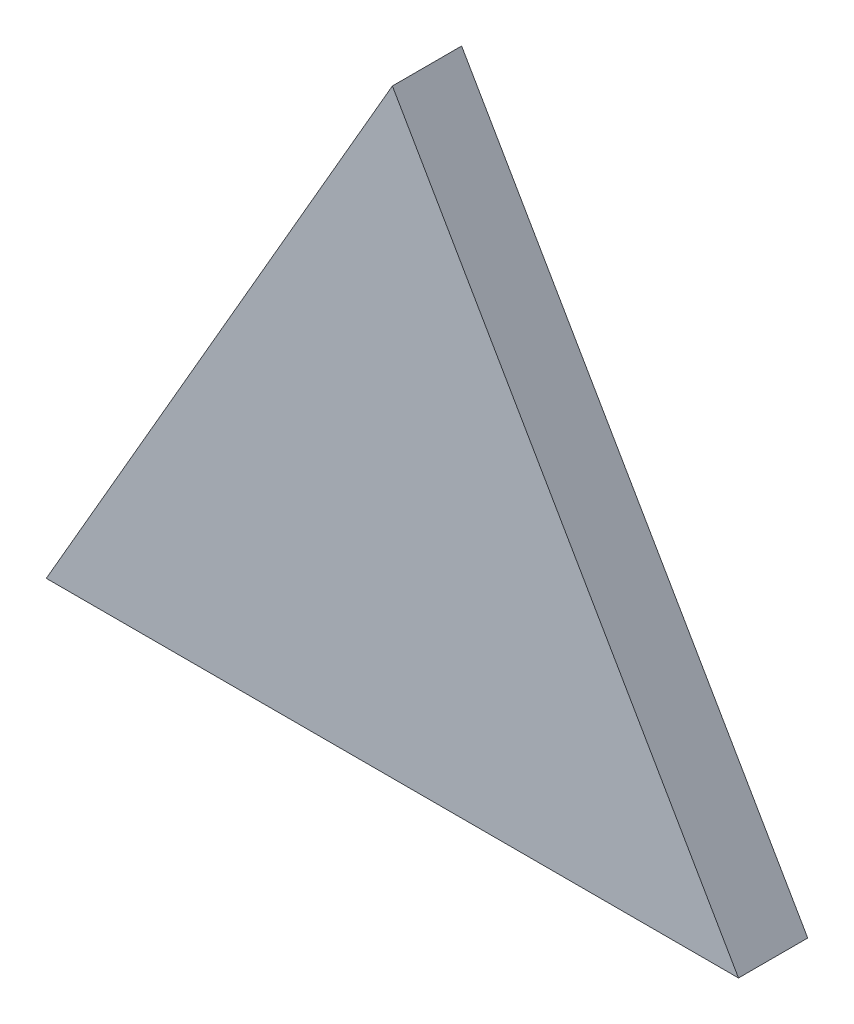
from build123d import *

# Parameters (mm, degrees)
BOSS_EXTRUDE1_DEPTH = 12.7


with BuildPart() as part:
    # Sketch1 → Boss-Extrude1 (new body)
    with BuildSketch(Plane.XY):
        Polygon((0, 73.323484187), (-63.5, -36.661742094), (63.5, -36.661742094), align=None)
    extrude(amount=BOSS_EXTRUDE1_DEPTH)


solid = part.part
